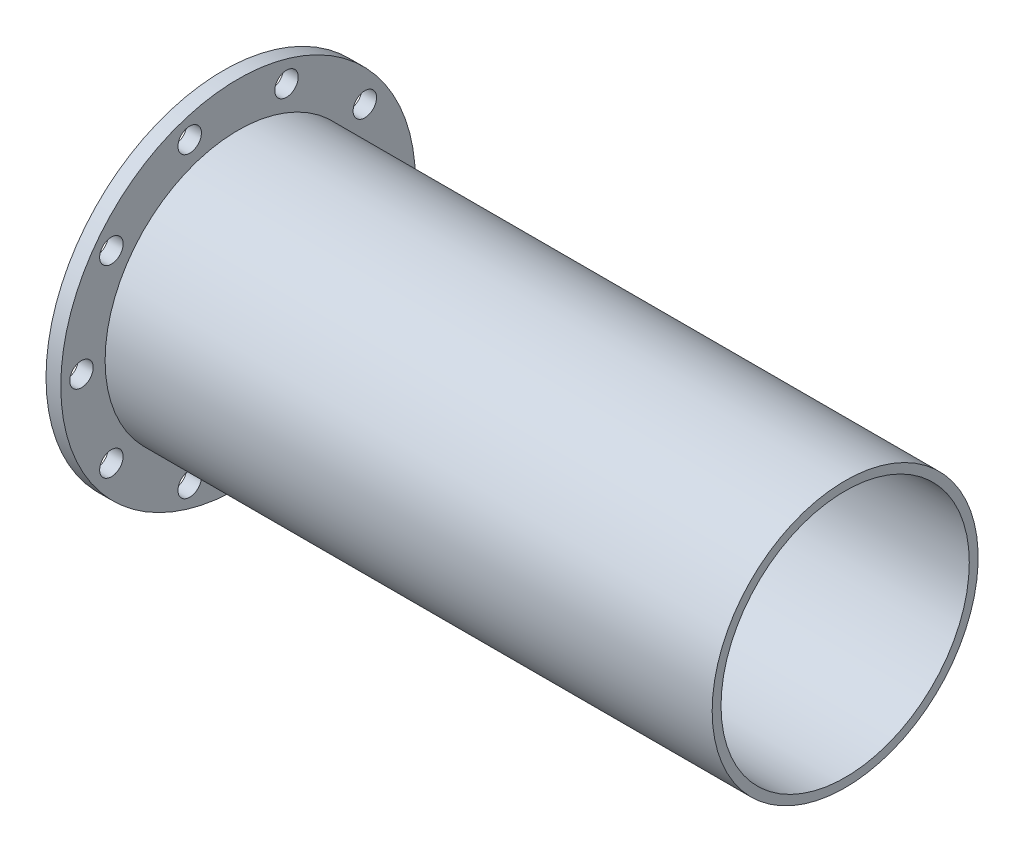
from build123d import *

# Parameters (mm, degrees)
F_3_8_CLEARANCE_HOLE1_D = 10.0838
CIRPATTERN1_COUNT       = 10


with BuildPart() as part:
    # Sketch1 → Revolve1 (revolve)
    with BuildSketch(Plane.XY, mode=Mode.PRIVATE) as revolve1_sk:
        Polygon((0, 76.2), (6.35, 76.2), (6.35, 57.15), (267.208, 57.15), (267.208, 53.34), (0, 53.34), align=None)
    revolve(revolve1_sk.sketch.rotate(Axis((0, 0, 0), (1, 0, 0)), 90), axis=Axis((0, 0, 0), (1, 0, 0)))

    # 3/8 Clearance Hole1 (through all)
    with Locations(Plane(origin=(6.35, 0, -67.31), x_dir=(0, 0, 1), z_dir=(1, 0, 0))):
        with Locations((0, 0)):
            f_3_8_clearance_hole1 = Hole(F_3_8_CLEARANCE_HOLE1_D / 2)

    # CirPattern1: 3/8 Clearance Hole1 ×10 about axis
    cirpattern1_axis = Axis((0, 0, 0), (1, 0, 0))
    for i in range(1, CIRPATTERN1_COUNT):
        add(f_3_8_clearance_hole1.rotate(cirpattern1_axis, i * 360 / CIRPATTERN1_COUNT), mode=Mode.SUBTRACT)


solid = part.part
